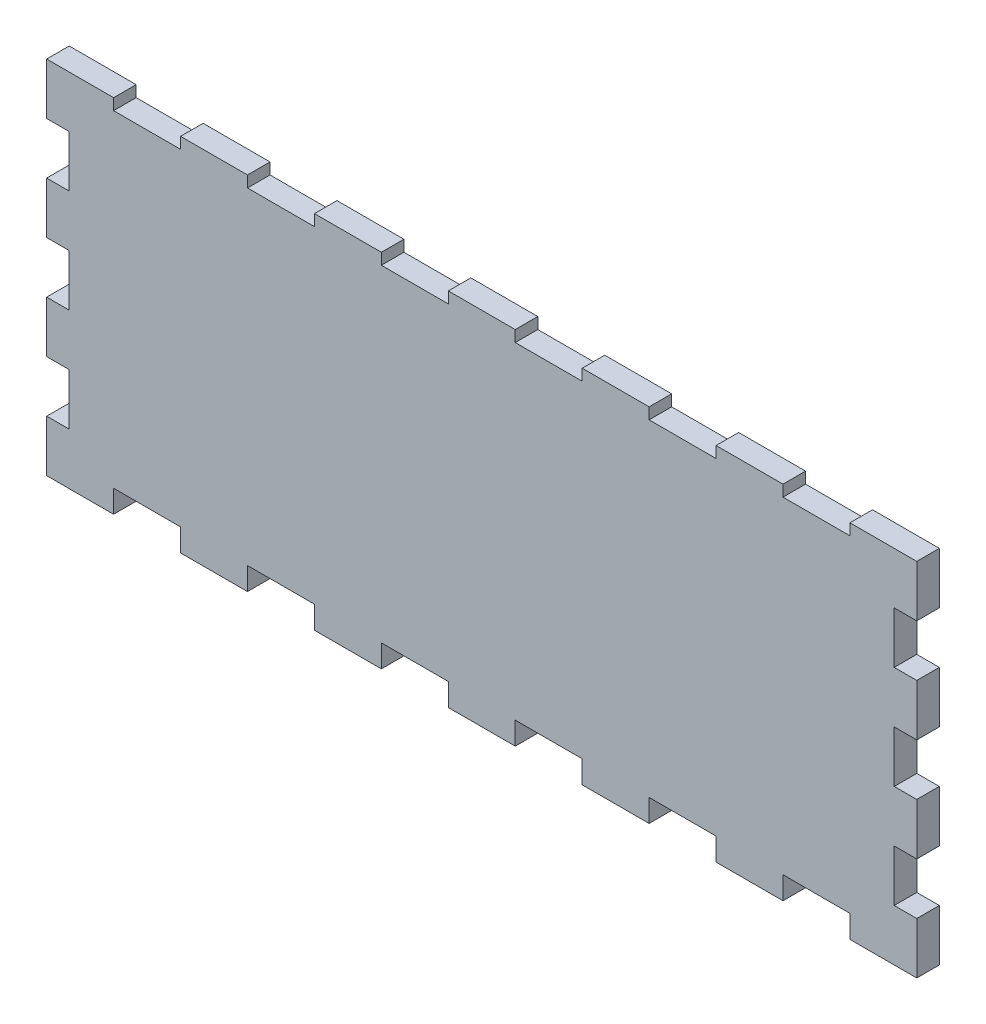
from build123d import *

# Parameters (mm, degrees)
ESBO_O1_W                = 231.5
ESBO_O1_H                = 96
RESSALTO_EXTRUS_O1_DEPTH = 6
CORTE_EXTRUS_O1_REACH    = 127.451
ESBO_O2_W                = 17.812307692
ESBO_O2_H                = 6
CORTE_EXTRUS_O3_REACH    = 127.451
ESBO_O4_W                = 6
ESBO_O4_H                = 13.715714286


with BuildPart() as part:
    # Esboço1 → Ressalto-extrusão1 (new body)
    with BuildSketch(Plane.XY):
        Rectangle(ESBO_O1_W, ESBO_O1_H)
    extrude(amount=RESSALTO_EXTRUS_O1_DEPTH)

    # Esboço2 → Corte-extrusão1 (cut, up to next)
    with BuildSketch(Plane(origin=(0, 0, 0), x_dir=(-1, 0, 0), z_dir=(0, 0, -1)), mode=Mode.PRIVATE) as corte_extrus_o1_sk1:
        with Locations((17.796153846, -45)):
            Rectangle(ESBO_O2_W, ESBO_O2_H)
    corte_extrus_o1_tool1 = extrude(corte_extrus_o1_sk1.sketch, amount=-CORTE_EXTRUS_O1_REACH, mode=Mode.PRIVATE) & part.part
    # Esboço2 → Corte-extrusão1 (cut, up to next)
    with BuildSketch(Plane(origin=(0, 0, 0), x_dir=(-1, 0, 0), z_dir=(0, 0, -1)), mode=Mode.PRIVATE) as corte_extrus_o1_sk2:
        with Locations((53.416153846, -45)):
            Rectangle(ESBO_O2_W, ESBO_O2_H)
    corte_extrus_o1_tool2 = extrude(corte_extrus_o1_sk2.sketch, amount=-CORTE_EXTRUS_O1_REACH, mode=Mode.PRIVATE) & part.part
    # Esboço2 → Corte-extrusão1 (cut, up to next)
    with BuildSketch(Plane(origin=(0, 0, 0), x_dir=(-1, 0, 0), z_dir=(0, 0, -1)), mode=Mode.PRIVATE) as corte_extrus_o1_sk3:
        with Locations((89.036153846, -45)):
            Rectangle(ESBO_O2_W, ESBO_O2_H)
    corte_extrus_o1_tool3 = extrude(corte_extrus_o1_sk3.sketch, amount=-CORTE_EXTRUS_O1_REACH, mode=Mode.PRIVATE) & part.part
    # Esboço2 → Corte-extrusão1 (cut, up to next)
    with BuildSketch(Plane(origin=(0, 0, 0), x_dir=(-1, 0, 0), z_dir=(0, 0, -1)), mode=Mode.PRIVATE) as corte_extrus_o1_sk4:
        with Locations((-17.823846154, -45)):
            Rectangle(ESBO_O2_W, ESBO_O2_H)
    corte_extrus_o1_tool4 = extrude(corte_extrus_o1_sk4.sketch, amount=-CORTE_EXTRUS_O1_REACH, mode=Mode.PRIVATE) & part.part
    # Esboço2 → Corte-extrusão1 (cut, up to next)
    with BuildSketch(Plane(origin=(0, 0, 0), x_dir=(-1, 0, 0), z_dir=(0, 0, -1)), mode=Mode.PRIVATE) as corte_extrus_o1_sk5:
        with Locations((-53.443846154, -45)):
            Rectangle(ESBO_O2_W, ESBO_O2_H)
    corte_extrus_o1_tool5 = extrude(corte_extrus_o1_sk5.sketch, amount=-CORTE_EXTRUS_O1_REACH, mode=Mode.PRIVATE) & part.part
    # Esboço2 → Corte-extrusão1 (cut, up to next)
    with BuildSketch(Plane(origin=(0, 0, 0), x_dir=(-1, 0, 0), z_dir=(0, 0, -1)), mode=Mode.PRIVATE) as corte_extrus_o1_sk6:
        with Locations((-89.063846154, -45)):
            Rectangle(ESBO_O2_W, ESBO_O2_H)
    corte_extrus_o1_tool6 = extrude(corte_extrus_o1_sk6.sketch, amount=-CORTE_EXTRUS_O1_REACH, mode=Mode.PRIVATE) & part.part
    # Esboço2 → Corte-extrusão1 (cut, up to next)
    with BuildSketch(Plane(origin=(0, 0, 0), x_dir=(-1, 0, 0), z_dir=(0, 0, -1)), mode=Mode.PRIVATE) as corte_extrus_o1_sk7:
        with Locations((-89.063846154, 48)):
            Rectangle(ESBO_O2_W, ESBO_O2_H)
    corte_extrus_o1_tool7 = extrude(corte_extrus_o1_sk7.sketch, amount=-CORTE_EXTRUS_O1_REACH, mode=Mode.PRIVATE) & part.part
    # Esboço2 → Corte-extrusão1 (cut, up to next)
    with BuildSketch(Plane(origin=(0, 0, 0), x_dir=(-1, 0, 0), z_dir=(0, 0, -1)), mode=Mode.PRIVATE) as corte_extrus_o1_sk8:
        with Locations((-53.443846154, 48)):
            Rectangle(ESBO_O2_W, ESBO_O2_H)
    corte_extrus_o1_tool8 = extrude(corte_extrus_o1_sk8.sketch, amount=-CORTE_EXTRUS_O1_REACH, mode=Mode.PRIVATE) & part.part
    # Esboço2 → Corte-extrusão1 (cut, up to next)
    with BuildSketch(Plane(origin=(0, 0, 0), x_dir=(-1, 0, 0), z_dir=(0, 0, -1)), mode=Mode.PRIVATE) as corte_extrus_o1_sk9:
        with Locations((-17.823846154, 48)):
            Rectangle(ESBO_O2_W, ESBO_O2_H)
    corte_extrus_o1_tool9 = extrude(corte_extrus_o1_sk9.sketch, amount=-CORTE_EXTRUS_O1_REACH, mode=Mode.PRIVATE) & part.part
    # Esboço2 → Corte-extrusão1 (cut, up to next)
    with BuildSketch(Plane(origin=(0, 0, 0), x_dir=(-1, 0, 0), z_dir=(0, 0, -1)), mode=Mode.PRIVATE) as corte_extrus_o1_sk10:
        with Locations((17.796153846, 48)):
            Rectangle(ESBO_O2_W, ESBO_O2_H)
    corte_extrus_o1_tool10 = extrude(corte_extrus_o1_sk10.sketch, amount=-CORTE_EXTRUS_O1_REACH, mode=Mode.PRIVATE) & part.part
    # Esboço2 → Corte-extrusão1 (cut, up to next)
    with BuildSketch(Plane(origin=(0, 0, 0), x_dir=(-1, 0, 0), z_dir=(0, 0, -1)), mode=Mode.PRIVATE) as corte_extrus_o1_sk11:
        with Locations((89.036153846, 48)):
            Rectangle(ESBO_O2_W, ESBO_O2_H)
    corte_extrus_o1_tool11 = extrude(corte_extrus_o1_sk11.sketch, amount=-CORTE_EXTRUS_O1_REACH, mode=Mode.PRIVATE) & part.part
    # Esboço2 → Corte-extrusão1 (cut, up to next)
    with BuildSketch(Plane(origin=(0, 0, 0), x_dir=(-1, 0, 0), z_dir=(0, 0, -1)), mode=Mode.PRIVATE) as corte_extrus_o1_sk12:
        with Locations((53.416153846, 48)):
            Rectangle(ESBO_O2_W, ESBO_O2_H)
    corte_extrus_o1_tool12 = extrude(corte_extrus_o1_sk12.sketch, amount=-CORTE_EXTRUS_O1_REACH, mode=Mode.PRIVATE) & part.part
    add(corte_extrus_o1_tool1.solids().sort_by_distance((-17.796154, -45, 0))[0], mode=Mode.SUBTRACT)
    add(corte_extrus_o1_tool2.solids().sort_by_distance((-53.416154, -45, 0))[0], mode=Mode.SUBTRACT)
    add(corte_extrus_o1_tool3.solids().sort_by_distance((-89.036154, -45, 0))[0], mode=Mode.SUBTRACT)
    add(corte_extrus_o1_tool4.solids().sort_by_distance((17.823846, -45, 0))[0], mode=Mode.SUBTRACT)
    add(corte_extrus_o1_tool5.solids().sort_by_distance((53.443846, -45, 0))[0], mode=Mode.SUBTRACT)
    add(corte_extrus_o1_tool6.solids().sort_by_distance((89.063846, -45, 0))[0], mode=Mode.SUBTRACT)
    add(corte_extrus_o1_tool7.solids().sort_by_distance((89.063846, 48, 0))[0], mode=Mode.SUBTRACT)
    add(corte_extrus_o1_tool8.solids().sort_by_distance((53.443846, 48, 0))[0], mode=Mode.SUBTRACT)
    add(corte_extrus_o1_tool9.solids().sort_by_distance((17.823846, 48, 0))[0], mode=Mode.SUBTRACT)
    add(corte_extrus_o1_tool10.solids().sort_by_distance((-17.796154, 48, 0))[0], mode=Mode.SUBTRACT)
    add(corte_extrus_o1_tool11.solids().sort_by_distance((-89.036154, 48, 0))[0], mode=Mode.SUBTRACT)
    add(corte_extrus_o1_tool12.solids().sort_by_distance((-53.416154, 48, 0))[0], mode=Mode.SUBTRACT)

    # Esboço4 → Corte-extrusão3 (cut, up to next)
    with BuildSketch(Plane(origin=(0, 0, 0), x_dir=(-1, 0, 0), z_dir=(0, 0, -1)), mode=Mode.PRIVATE) as corte_extrus_o3_sk1:
        with Locations((112.75, -0.002142857)):
            Rectangle(ESBO_O4_W, ESBO_O4_H)
    corte_extrus_o3_tool1 = extrude(corte_extrus_o3_sk1.sketch, amount=-CORTE_EXTRUS_O3_REACH, mode=Mode.PRIVATE) & part.part
    # Esboço4 → Corte-extrusão3 (cut, up to next)
    with BuildSketch(Plane(origin=(0, 0, 0), x_dir=(-1, 0, 0), z_dir=(0, 0, -1)), mode=Mode.PRIVATE) as corte_extrus_o3_sk2:
        with Locations((112.75, 27.427857143)):
            Rectangle(ESBO_O4_W, ESBO_O4_H)
    corte_extrus_o3_tool2 = extrude(corte_extrus_o3_sk2.sketch, amount=-CORTE_EXTRUS_O3_REACH, mode=Mode.PRIVATE) & part.part
    # Esboço4 → Corte-extrusão3 (cut, up to next)
    with BuildSketch(Plane(origin=(0, 0, 0), x_dir=(-1, 0, 0), z_dir=(0, 0, -1)), mode=Mode.PRIVATE) as corte_extrus_o3_sk3:
        with Locations((-112.75, 27.427857143)):
            Rectangle(ESBO_O4_W, ESBO_O4_H)
    corte_extrus_o3_tool3 = extrude(corte_extrus_o3_sk3.sketch, amount=-CORTE_EXTRUS_O3_REACH, mode=Mode.PRIVATE) & part.part
    # Esboço4 → Corte-extrusão3 (cut, up to next)
    with BuildSketch(Plane(origin=(0, 0, 0), x_dir=(-1, 0, 0), z_dir=(0, 0, -1)), mode=Mode.PRIVATE) as corte_extrus_o3_sk4:
        with Locations((-112.75, -0.002142857)):
            Rectangle(ESBO_O4_W, ESBO_O4_H)
    corte_extrus_o3_tool4 = extrude(corte_extrus_o3_sk4.sketch, amount=-CORTE_EXTRUS_O3_REACH, mode=Mode.PRIVATE) & part.part
    # Esboço4 → Corte-extrusão3 (cut, up to next)
    with BuildSketch(Plane(origin=(0, 0, 0), x_dir=(-1, 0, 0), z_dir=(0, 0, -1)), mode=Mode.PRIVATE) as corte_extrus_o3_sk5:
        with Locations((-112.75, -27.432142857)):
            Rectangle(ESBO_O4_W, ESBO_O4_H)
    corte_extrus_o3_tool5 = extrude(corte_extrus_o3_sk5.sketch, amount=-CORTE_EXTRUS_O3_REACH, mode=Mode.PRIVATE) & part.part
    # Esboço4 → Corte-extrusão3 (cut, up to next)
    with BuildSketch(Plane(origin=(0, 0, 0), x_dir=(-1, 0, 0), z_dir=(0, 0, -1)), mode=Mode.PRIVATE) as corte_extrus_o3_sk6:
        with Locations((112.75, -27.432142857)):
            Rectangle(ESBO_O4_W, ESBO_O4_H)
    corte_extrus_o3_tool6 = extrude(corte_extrus_o3_sk6.sketch, amount=-CORTE_EXTRUS_O3_REACH, mode=Mode.PRIVATE) & part.part
    add(corte_extrus_o3_tool1.solids().sort_by_distance((-112.75, -0.002143, 0))[0], mode=Mode.SUBTRACT)
    add(corte_extrus_o3_tool2.solids().sort_by_distance((-112.75, 27.427857, 0))[0], mode=Mode.SUBTRACT)
    add(corte_extrus_o3_tool3.solids().sort_by_distance((112.75, 27.427857, 0))[0], mode=Mode.SUBTRACT)
    add(corte_extrus_o3_tool4.solids().sort_by_distance((112.75, -0.002143, 0))[0], mode=Mode.SUBTRACT)
    add(corte_extrus_o3_tool5.solids().sort_by_distance((112.75, -27.432143, 0))[0], mode=Mode.SUBTRACT)
    add(corte_extrus_o3_tool6.solids().sort_by_distance((-112.75, -27.432143, 0))[0], mode=Mode.SUBTRACT)


solid = part.part
